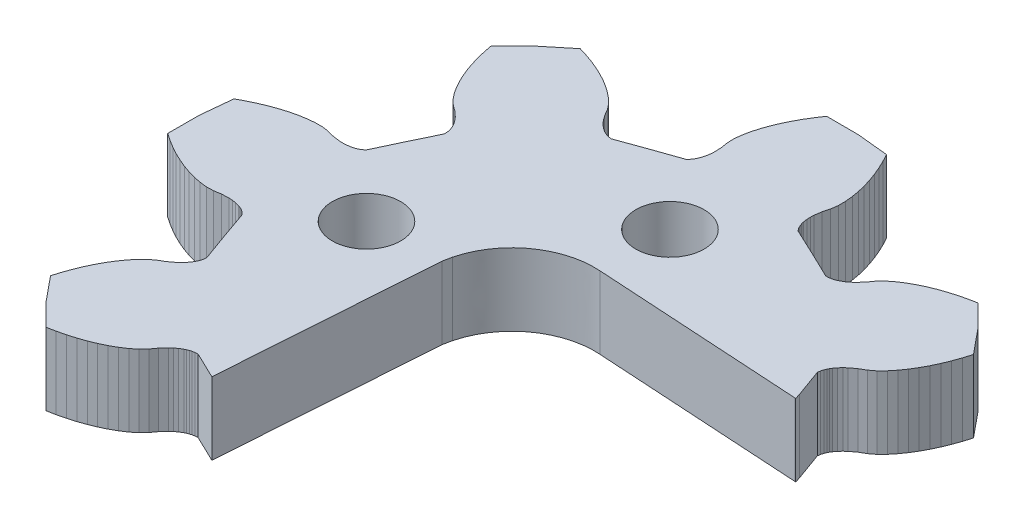
from build123d import *

# Parameters (mm, degrees)
SKETCH1_R           = 1.4998
BOSS_EXTRUDE1_DEPTH = 3.175


with BuildPart() as part:
    # Sketch1 → Boss-Extrude1 (new body)
    with BuildSketch(Plane(origin=(0, 0, 0), x_dir=(1, 0, 0), z_dir=(0, 1, 0))):
        with BuildLine():
            Line((158.205460584, 184.378237226), (158.281460584, 184.757537226))
            add(Edge.make_bspline(
                [(162.029306606, 187.473849025), (160.321509273, 187.589095055), (158.720839063, 186.475413969), (158.281460584, 184.757537226)],
                knots=[0.222652481, 0.222652481, 0.222652481, 0.222652481, 0.4, 0.4, 0.4, 0.4], degree=3))
            Line((162.029306606, 187.473849025), (171.147660585, 186.920137227))
            Line((171.147660585, 186.920137227), (171.180760585, 186.920137227))
            Line((171.180760585, 186.920137227), (171.102060585, 187.173637227))
            Line((171.102060585, 187.173637227), (170.665260585, 188.381337227))
            Line((170.665260585, 188.381337227), (170.682360585, 188.514737227))
            Line((170.682360585, 188.514737227), (170.712860585, 188.621037227))
            Line((170.712860585, 188.621037227), (170.750360585, 188.712937227))
            Line((170.750360585, 188.712937227), (170.792660585, 188.794837227))
            Line((170.792660585, 188.794837227), (170.838660585, 188.869937227))
            Line((170.838660585, 188.869937227), (170.938960585, 189.004037227))
            Line((170.938960585, 189.004037227), (171.047760585, 189.122537227))
            Line((171.047760585, 189.122537227), (171.163460585, 189.228737227))
            Line((171.163460585, 189.228737227), (171.410560585, 189.412537227))
            Line((171.410560585, 189.412537227), (171.675260585, 189.566037227))
            Line((171.675260585, 189.566037227), (171.920860585, 189.752437227))
            Line((171.920860585, 189.752437227), (172.142260585, 189.979737227))
            Line((172.142260585, 189.979737227), (172.347960585, 190.231937227))
            Line((172.347960585, 190.231937227), (172.539760585, 190.505137227))
            Line((172.539760585, 190.505137227), (172.717860585, 190.796937227))
            Line((172.717860585, 190.796937227), (172.883060585, 191.105537227))
            Line((172.883060585, 191.105537227), (173.034960585, 191.430137227))
            Line((173.034960585, 191.430137227), (173.173760585, 191.769337227))
            Line((173.173760585, 191.769337227), (173.298760585, 192.122437227))
            Line((173.298760585, 192.122437227), (173.410260584, 192.488737226))
            Line((173.410260584, 192.488737226), (172.531160584, 193.561237226))
            Line((172.531160584, 193.561237226), (171.553360584, 194.544837226))
            Line((171.553360584, 194.544837226), (171.177660584, 194.471137226))
            Line((171.177660584, 194.471137226), (170.813760584, 194.382437226))
            Line((170.813760584, 194.382437226), (170.462160584, 194.278937226))
            Line((170.462160584, 194.278937226), (170.123960584, 194.160737226))
            Line((170.123960584, 194.160737226), (169.800060584, 194.027737226))
            Line((169.800060584, 194.027737226), (169.491760584, 193.880037226))
            Line((169.491760584, 193.880037226), (169.200560584, 193.717137226))
            Line((169.200560584, 193.717137226), (168.928660584, 193.538137226))
            Line((168.928660584, 193.538137226), (168.680060584, 193.340837226))
            Line((168.680060584, 193.340837226), (168.469460584, 193.115537226))
            Line((168.469460584, 193.115537226), (168.290060584, 192.867637226))
            Line((168.290060584, 192.867637226), (168.082060584, 192.640537226))
            Line((168.082060584, 192.640537226), (167.964660584, 192.536237226))
            Line((167.964660584, 192.536237226), (167.835860584, 192.440037226))
            Line((167.835860584, 192.440037226), (167.692260584, 192.353837226))
            Line((167.692260584, 192.353837226), (167.612960584, 192.315737226))
            Line((167.612960584, 192.315737226), (167.526960584, 192.281837226))
            Line((167.526960584, 192.281837226), (167.431860584, 192.253937226))
            Line((167.431860584, 192.253937226), (167.322960584, 192.234537226))
            Line((167.322960584, 192.234537226), (167.188460584, 192.230837226))
            Line((167.188460584, 192.230837226), (166.031360584, 192.787937226))
            Line((166.031360584, 192.787937226), (164.868560584, 193.333137226))
            Line((164.868560584, 193.333137226), (164.786560584, 193.439637226))
            Line((164.786560584, 193.439637226), (164.732860584, 193.536237226))
            Line((164.732860584, 193.536237226), (164.694460584, 193.627637226))
            Line((164.694460584, 193.627637226), (164.666360584, 193.715637226))
            Line((164.666360584, 193.715637226), (164.645860584, 193.801237226))
            Line((164.645860584, 193.801237226), (164.621760584, 193.967137226))
            Line((164.621760584, 193.967137226), (164.615160584, 194.127637226))
            Line((164.615160584, 194.127637226), (164.621660584, 194.284537226))
            Line((164.621660584, 194.284537226), (164.666460584, 194.589337226))
            Line((164.666460584, 194.589337226), (164.745160584, 194.885137226))
            Line((164.745160584, 194.885137226), (164.786960584, 195.190637226))
            Line((164.786960584, 195.190637226), (164.782860584, 195.507837226))
            Line((164.782860584, 195.507837226), (164.749860584, 195.831637226))
            Line((164.749860584, 195.831637226), (164.692260584, 196.160337226))
            Line((164.692260584, 196.160337226), (164.612060584, 196.492737226))
            Line((164.612060584, 196.492737226), (164.510460584, 196.827837226))
            Line((164.510460584, 196.827837226), (164.388460584, 197.164737226))
            Line((164.388460584, 197.164737226), (164.246660584, 197.502637226))
            Line((164.246660584, 197.502637226), (164.085560584, 197.840737226))
            Line((164.085560584, 197.840737226), (163.905360584, 198.178437226))
            Line((163.905360584, 198.178437226), (162.525260584, 198.315237226))
            Line((162.525260584, 198.315237226), (161.138460584, 198.319337226))
            Line((161.138460584, 198.319337226), (160.924860584, 198.001637226))
            Line((160.924860584, 198.001637226), (160.730160584, 197.681537226))
            Line((160.730160584, 197.681537226), (160.554760584, 197.359737226))
            Line((160.554760584, 197.359737226), (160.399260584, 197.037037226))
            Line((160.399260584, 197.037037226), (160.264260584, 196.713937226))
            Line((160.264260584, 196.713937226), (160.150560584, 196.391537226))
            Line((160.150560584, 196.391537226), (160.059960584, 196.070337226))
            Line((160.059960584, 196.070337226), (159.994360584, 195.751437226))
            Line((159.994360584, 195.751437226), (159.957960584, 195.436437226))
            Line((159.957960584, 195.436437226), (159.968560584, 195.128137226))
            Line((159.968560584, 195.128137226), (160.016760584, 194.826037226))
            Line((160.016760584, 194.826037226), (160.030460584, 194.518237226))
            Line((160.030460584, 194.518237226), (160.021160584, 194.361537226))
            Line((160.021160584, 194.361537226), (159.998060584, 194.202437226))
            Line((159.998060584, 194.202437226), (159.957560584, 194.039837226))
            Line((159.957560584, 194.039837226), (159.928360584, 193.956837226))
            Line((159.928360584, 193.956837226), (159.891460584, 193.872137226))
            Line((159.891460584, 193.872137226), (159.843860584, 193.785037226))
            Line((159.843860584, 193.785037226), (159.780760584, 193.694337226))
            Line((159.780760584, 193.694337226), (159.688160584, 193.596837226))
            Line((159.688160584, 193.596837226), (158.476060584, 193.172537226))
            Line((158.476060584, 193.172537226), (157.268360584, 192.735737226))
            Line((157.268360584, 192.735737226), (157.135060584, 192.752937226))
            Line((157.135060584, 192.752937226), (157.028660584, 192.783337226))
            Line((157.028660584, 192.783337226), (156.936860584, 192.820837226))
            Line((156.936860584, 192.820837226), (156.854860584, 192.863237226))
            Line((156.854860584, 192.863237226), (156.779760584, 192.909137226))
            Line((156.779760584, 192.909137226), (156.645560584, 193.009637226))
            Line((156.645560584, 193.009637226), (156.527260584, 193.118337226))
            Line((156.527260584, 193.118337226), (156.420960584, 193.233837226))
            Line((156.420960584, 193.233837226), (156.237160584, 193.481137226))
            Line((156.237160584, 193.481137226), (156.083760584, 193.745837226))
            Line((156.083760584, 193.745837226), (155.897160584, 193.991537226))
            Line((155.897160584, 193.991537226), (155.670060584, 194.212837226))
            Line((155.670060584, 194.212837226), (155.417760584, 194.418537226))
            Line((155.417760584, 194.418537226), (155.144560584, 194.610237226))
            Line((155.144560584, 194.610237226), (154.852760584, 194.788537226))
            Line((154.852760584, 194.788537226), (154.543960584, 194.953537226))
            Line((154.543960584, 194.953537226), (154.219560584, 195.105637226))
            Line((154.219560584, 195.105637226), (153.880360584, 195.244237226))
            Line((153.880360584, 195.244237226), (153.527360584, 195.369437226))
            Line((153.527360584, 195.369437226), (153.161060584, 195.480837226))
            Line((153.161060584, 195.480837226), (152.088460584, 194.601637226))
            Line((152.088460584, 194.601637226), (151.104960584, 193.623837226))
            Line((151.104960584, 193.623837226), (151.178560584, 193.248237226))
            Line((151.178560584, 193.248237226), (151.267160584, 192.884237226))
            Line((151.267160584, 192.884237226), (151.370860584, 192.532837226))
            Line((151.370860584, 192.532837226), (151.488960584, 192.194537226))
            Line((151.488960584, 192.194537226), (151.621960584, 191.870537226))
            Line((151.621960584, 191.870537226), (151.769660584, 191.562237226))
            Line((151.769660584, 191.562237226), (151.932560584, 191.271037226))
            Line((151.932560584, 191.271037226), (152.111660584, 190.999137226))
            Line((152.111660584, 190.999137226), (152.308860584, 190.750637226))
            Line((152.308860584, 190.750637226), (152.534260584, 190.540237226))
            Line((152.534260584, 190.540237226), (152.781960584, 190.360637226))
            Line((152.781960584, 190.360637226), (153.009260584, 190.152637226))
            Line((153.009260584, 190.152637226), (153.113460584, 190.035237226))
            Line((153.113460584, 190.035237226), (153.209660584, 189.906437226))
            Line((153.209660584, 189.906437226), (153.295860584, 189.762737226))
            Line((153.295860584, 189.762737226), (153.334060584, 189.683437226))
            Line((153.334060584, 189.683437226), (153.367860584, 189.597437226))
            Line((153.367860584, 189.597437226), (153.395860584, 189.502337226))
            Line((153.395860584, 189.502337226), (153.415060584, 189.393437226))
            Line((153.415060584, 189.393437226), (153.418660584, 189.259137226))
            Line((153.418660584, 189.259137226), (152.861660584, 188.102037226))
            Line((152.861660584, 188.102037226), (152.316560584, 186.939237226))
            Line((152.316560584, 186.939237226), (152.210060584, 186.857137226))
            Line((152.210060584, 186.857137226), (152.113460584, 186.803337226))
            Line((152.113460584, 186.803337226), (152.021960584, 186.765037226))
            Line((152.021960584, 186.765037226), (151.934060584, 186.736837226))
            Line((151.934060584, 186.736837226), (151.848460584, 186.716337226))
            Line((151.848460584, 186.716337226), (151.682560584, 186.692437226))
            Line((151.682560584, 186.692437226), (151.521860584, 186.685637226))
            Line((151.521860584, 186.685637226), (151.365160584, 186.692237226))
            Line((151.365160584, 186.692237226), (151.060360584, 186.736937226))
            Line((151.060360584, 186.736937226), (150.764660584, 186.815737226))
            Line((150.764660584, 186.815737226), (150.459160584, 186.857537226))
            Line((150.459160584, 186.857537226), (150.141960584, 186.853437226))
            Line((150.141960584, 186.853437226), (149.818060584, 186.820537226))
            Line((149.818060584, 186.820537226), (149.489460584, 186.762837226))
            Line((149.489460584, 186.762837226), (149.157060584, 186.682537226))
            Line((149.157060584, 186.682537226), (148.821960584, 186.581037226))
            Line((148.821960584, 186.581037226), (148.485160584, 186.459137226))
            Line((148.485160584, 186.459137226), (148.147160584, 186.317237226))
            Line((148.147160584, 186.317237226), (147.809060584, 186.156037226))
            Line((147.809060584, 186.156037226), (147.471160584, 185.975937226))
            Line((147.471160584, 185.975937226), (147.334360584, 184.595737226))
            Line((147.334360584, 184.595737226), (147.330460584, 183.209037226))
            Line((147.330460584, 183.209037226), (147.648060584, 182.995437226))
            Line((147.648060584, 182.995437226), (147.968260584, 182.800737226))
            Line((147.968260584, 182.800737226), (148.289960584, 182.625437226))
            Line((148.289960584, 182.625437226), (148.612760584, 182.469737226))
            Line((148.612760584, 182.469737226), (148.935760584, 182.334837226))
            Line((148.935760584, 182.334837226), (149.258160584, 182.221237226))
            Line((149.258160584, 182.221237226), (149.579360584, 182.130537226))
            Line((149.579360584, 182.130537226), (149.898260584, 182.064837226))
            Line((149.898260584, 182.064837226), (150.213360584, 182.028537226))
            Line((150.213360584, 182.028537226), (150.521560584, 182.039137226))
            Line((150.521560584, 182.039137226), (150.823760584, 182.087337226))
            Line((150.823760584, 182.087337226), (151.131460584, 182.100937226))
            Line((151.131460584, 182.100937226), (151.288060584, 182.091637226))
            Line((151.288060584, 182.091637226), (151.447360584, 182.068637226))
            Line((151.447360584, 182.068637226), (151.609860584, 182.027937226))
            Line((151.609860584, 182.027937226), (151.692960584, 181.998937226))
            Line((151.692960584, 181.998937226), (151.777660584, 181.962037226))
            Line((151.777660584, 181.962037226), (151.864660584, 181.914537226))
            Line((151.864660584, 181.914537226), (151.955260584, 181.851237226))
            Line((151.955260584, 181.851237226), (152.052860584, 181.758737226))
            Line((152.052860584, 181.758737226), (152.477260584, 180.546537226))
            Line((152.477260584, 180.546537226), (152.913860584, 179.339037226))
            Line((152.913860584, 179.339037226), (152.896660584, 179.205537226))
            Line((152.896660584, 179.205537226), (152.866460584, 179.099237226))
            Line((152.866460584, 179.099237226), (152.828960584, 179.007437226))
            Line((152.828960584, 179.007437226), (152.786460584, 178.925337226))
            Line((152.786460584, 178.925337226), (152.740460584, 178.850437226))
            Line((152.740460584, 178.850437226), (152.640160584, 178.716137226))
            Line((152.640160584, 178.716137226), (152.531260584, 178.597837226))
            Line((152.531260584, 178.597837226), (152.415760584, 178.491537226))
            Line((152.415760584, 178.491537226), (152.168560584, 178.307837226))
            Line((152.168560584, 178.307837226), (151.903860584, 178.154237226))
            Line((151.903860584, 178.154237226), (151.658260584, 177.967837226))
            Line((151.658260584, 177.967837226), (151.436960584, 177.740537226))
            Line((151.436960584, 177.740537226), (151.231060584, 177.488337226))
            Line((151.231060584, 177.488337226), (151.039560584, 177.215037226))
            Line((151.039560584, 177.215037226), (150.861260584, 176.923337226))
            Line((150.861260584, 176.923337226), (150.696160584, 176.614637226))
            Line((150.696160584, 176.614637226), (150.544160584, 176.290137226))
            Line((150.544160584, 176.290137226), (150.405460584, 175.950937226))
            Line((150.405460584, 175.950937226), (150.280260584, 175.597837226))
            Line((150.280260584, 175.597837226), (150.168960584, 175.231537226))
            Line((150.168960584, 175.231537226), (151.047960584, 174.159037226))
            Line((151.047960584, 174.159037226), (152.025860584, 173.175537226))
            Line((152.025860584, 173.175537226), (152.401460584, 173.249237226))
            Line((152.401460584, 173.249237226), (152.765460584, 173.337937226))
            Line((152.765460584, 173.337937226), (153.117060584, 173.441337226))
            Line((153.117060584, 173.441337226), (153.455160584, 173.559537226))
            Line((153.455160584, 173.559537226), (153.779160584, 173.692437226))
            Line((153.779160584, 173.692437226), (154.087460584, 173.840237226))
            Line((154.087460584, 173.840237226), (154.378760584, 174.003137226))
            Line((154.378760584, 174.003137226), (154.650660584, 174.182237226))
            Line((154.650660584, 174.182237226), (154.899060584, 174.379437226))
            Line((154.899060584, 174.379437226), (155.109560584, 174.604737226))
            Line((155.109560584, 174.604737226), (155.289060584, 174.852537226))
            Line((155.289060584, 174.852537226), (155.497060584, 175.079737226))
            Line((155.497060584, 175.079737226), (155.614460584, 175.184037226))
            Line((155.614460584, 175.184037226), (155.743260584, 175.280137226))
            Line((155.743260584, 175.280137226), (155.886960584, 175.366537226))
            Line((155.886960584, 175.366537226), (155.966360584, 175.404537226))
            Line((155.966360584, 175.404537226), (156.052260584, 175.438437226))
            Line((156.052260584, 175.438437226), (156.147360584, 175.466337226))
            Line((156.147360584, 175.466337226), (156.256260584, 175.485837226))
            Line((156.256260584, 175.485837226), (156.390660584, 175.489337226))
            Line((156.390660584, 175.489337226), (157.547760584, 174.932137226))
            Line((157.547760584, 174.932137226), (158.205460584, 184.378237226))
        make_face()
        with Locations(Location((155.031360584, 184.232937226, 0), (0, 0, 270))):
            Circle(SKETCH1_R, mode=Mode.SUBTRACT)
        with Locations(Location((161.998160584, 190.583137226, 0), (0, 0, 270))):
            Circle(SKETCH1_R, mode=Mode.SUBTRACT)
    extrude(amount=BOSS_EXTRUDE1_DEPTH)


solid = part.part
